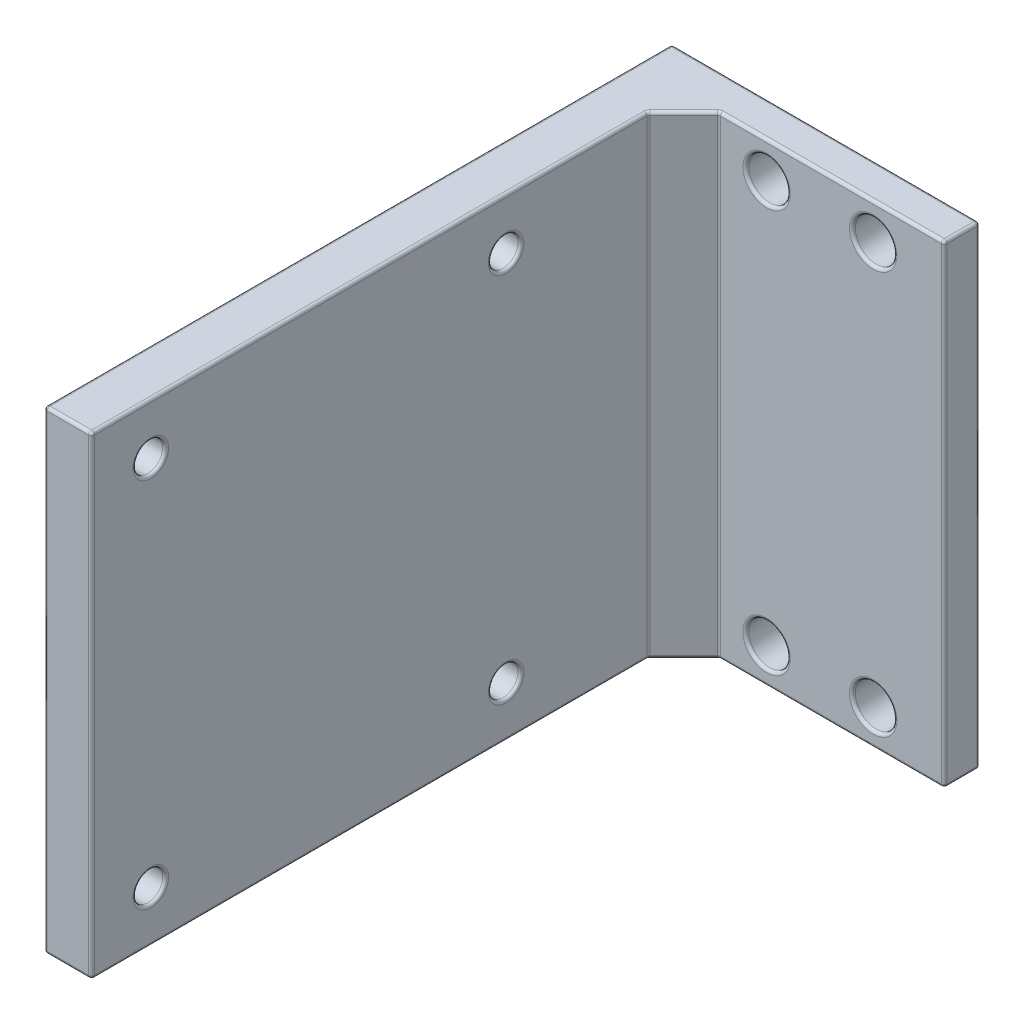
from build123d import *

# Parameters (mm, degrees)
SKETCH1_W           = 40
SKETCH1_H           = 26
SKETCH1_R           = 1.75
BOSS_EXTRUDE1_DEPTH = 3
SKETCH2_W           = 4
SKETCH2_H           = 40
BOSS_EXTRUDE2_DEPTH = 50
SKETCH3_R           = 1.25
CUT_EXTRUDE1_DEPTH  = 50
CHAMFER1_SIZE       = 3
FILLET2_R           = 0.25


with BuildPart() as part:
    # Sketch1 → Boss-Extrude1 (new body)
    with BuildSketch(Plane(origin=(0, 0, 0), x_dir=(0, 1, 0), z_dir=(0, 0, 1))):
        with Locations((0, 7)):
            Rectangle(SKETCH1_W, SKETCH1_H)
        with Locations(Location((-17, 0, 0), (0, 0, 270))):
            Circle(SKETCH1_R, mode=Mode.SUBTRACT)
        with Locations(Location((17, 0, 0), (0, 0, 270))):
            Circle(SKETCH1_R, mode=Mode.SUBTRACT)
        with Locations(Location((17, 9, 0), (0, 0, 270))):
            Circle(SKETCH1_R, mode=Mode.SUBTRACT)
        with Locations(Location((-17, 9, 0), (0, 0, 270))):
            Circle(SKETCH1_R, mode=Mode.SUBTRACT)
    extrude(amount=BOSS_EXTRUDE1_DEPTH)

    # Sketch2 → Boss-Extrude2 (add)
    with BuildSketch(Plane.XY.offset(3)):
        with Locations((-18, 0)):
            Rectangle(SKETCH2_W, SKETCH2_H)
    extrude(amount=BOSS_EXTRUDE2_DEPTH)

    # Sketch3 → Cut-Extrude1 (cut)
    with BuildSketch(Plane(origin=(-20, 0, 0), x_dir=(0, -1, 0), z_dir=(-1, 0, 0))):
        with Locations(Location((-15.7, 48, 0), (0, 0, 90))):
            Circle(SKETCH3_R)
        with Locations(Location((15.7, 48, 0), (0, 0, 90))):
            Circle(SKETCH3_R)
        with Locations(Location((15.7, 18, 0), (0, 0, 90))):
            Circle(SKETCH3_R)
        with Locations(Location((-15.7, 18, 0), (0, 0, 90))):
            Circle(SKETCH3_R)
    extrude(amount=-CUT_EXTRUDE1_DEPTH, mode=Mode.SUBTRACT)

    # Chamfer1
    chamfer1_edges = [part.edges().sort_by_distance(p)[0] for p in [
        (-16, 0, 3),
    ]]
    chamfer(chamfer1_edges, length=CHAMFER1_SIZE)

    # Fillet2
    fillet2_edges = [part.edges().sort_by_distance(p)[0] for p in [
        (-1.75, -17, 0),
        (-1.75, -17, 3),
        (-1.75, 17, 0),
        (-1.75, 17, 3),
        (6, 0, 3),
        (-10.75, 17, 0),
        (-10.75, 17, 3),
        (-10.75, -17, 0),
        (-10.75, -17, 3),
        (-16, -20, 29.5),
        (-16, 20, 29.5),
        (-20, 0, 53),
        (-18, -20, 53),
        (-16, 0, 53),
        (-18, 20, 53),
        (-16, 15.7, 16.75),
        (-3.5, 20, 3),
        (6, 0, 0),
        (-20, 15.7, 16.75),
        (-16, -15.7, 16.75),
        (-20, -15.7, 16.75),
        (-7, -20, 0),
        (-16, -15.7, 46.75),
        (-20, -15.7, 46.75),
        (-16, 15.7, 46.75),
        (-20, 15.7, 46.75),
        (-20, 0, 0),
        (-7, 20, 0),
        (-16, 0, 6),
        (-3.5, -20, 3),
        (-13, 0, 3),
        (-14.5, 20, 4.5),
        (-14.5, -20, 4.5),
        (6, 20, 1.5),
        (6, -20, 1.5),
        (-20, -20, 26.5),
        (-20, 20, 26.5),
    ]]
    fillet(fillet2_edges, radius=FILLET2_R)


solid = part.part
